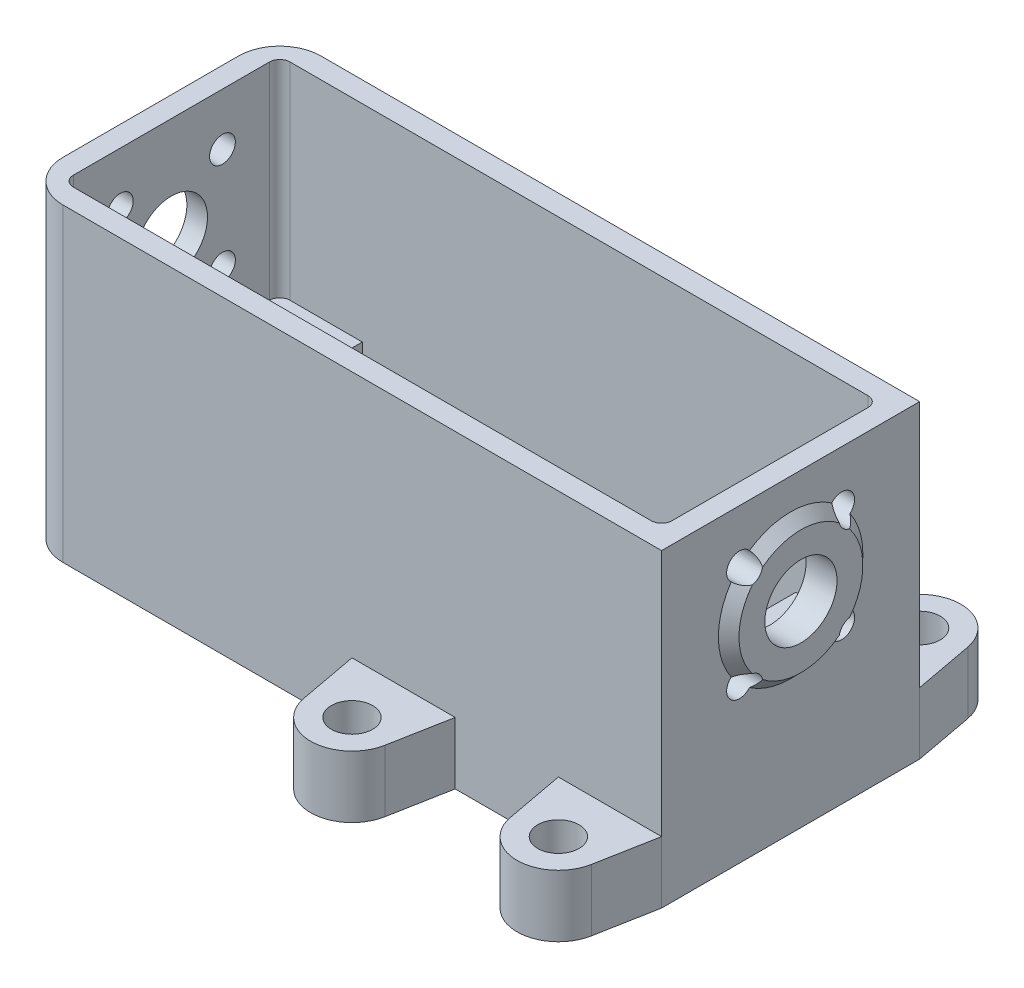
from build123d import *

# Parameters (mm, degrees)
SKETCH_1_W          = 62
SKETCH_1_H          = 25
EXTRUDE_1_DEPTH     = 30
SHELL_1_T           = -2
SKETCH_2_W          = 8
SKETCH_2_H          = 21
EXTRUDE_2_DEPTH     = 8
SKETCH_3_R          = 2
CUT_EXTRUDE_1_DEPTH = 39.951893407
SKETCH_4_R          = 6
CUT_EXTRUDE_2_DEPTH = 44.603325561
SKETCH_5_R          = 2
EXTRUDE_3_DEPTH     = 6
SKETCH_6_R          = 7
EXTRUDE_4_DEPTH     = 1
SKETCH_10_R         = 3.5
SKETCH_10_R_2       = 1.25
CUT_EXTRUDE_3_DEPTH = 74.015409333
FILLET_1_R          = 4
FILLET_2_R          = 1


with BuildPart() as part:
    # 草图1 → 凸台-拉伸1 (new body)
    with BuildSketch(Plane(origin=(0, 0, 0), x_dir=(1, 0, 0), z_dir=(0, 1, 0))):
        Rectangle(SKETCH_1_W, SKETCH_1_H)
    extrude(amount=EXTRUDE_1_DEPTH)

    # 抽壳1
    shell_1_openings = [part.faces().sort_by_distance(p)[0] for p in [
        (0, 30, 0),
    ]]
    offset(amount=SHELL_1_T, openings=shell_1_openings, kind=Kind.INTERSECTION)

    # 草图2 → 凸台-拉伸2 (add)
    with BuildSketch(Plane(origin=(0, 2, 0), x_dir=(1, 0, 0), z_dir=(0, 1, 0))):
        with Locations((-25, 0)):
            Rectangle(SKETCH_2_W, SKETCH_2_H)
        with Locations((25, 0)):
            Rectangle(SKETCH_2_W, SKETCH_2_H)
    extrude(amount=EXTRUDE_2_DEPTH)

    # 草图3 → 切除-拉伸1 (cut, through all)
    with BuildSketch(Plane(origin=(0, 10, 0), x_dir=(1, 0, 0), z_dir=(0, 1, 0))):
        with Locations(Location((25, -5, 0), (0, 0, 270))):
            Circle(SKETCH_3_R)
        with Locations(Location((25, 5, 0), (0, 0, 270))):
            Circle(SKETCH_3_R)
        with Locations(Location((-25, 5, 0), (0, 0, 90))):
            Circle(SKETCH_3_R)
        with Locations(Location((-25, -5, 0), (0, 0, 90))):
            Circle(SKETCH_3_R)
    extrude(amount=-CUT_EXTRUDE_1_DEPTH, mode=Mode.SUBTRACT)

    # 草图4 → 切除-拉伸2 (cut, through all)
    with BuildSketch(Plane(origin=(0, 2, 0), x_dir=(1, 0, 0), z_dir=(0, 1, 0))):
        with Locations(Location((-12, 0, 0), (0, 0, 270))):
            Circle(SKETCH_4_R)
    extrude(amount=-CUT_EXTRUDE_2_DEPTH, mode=Mode.SUBTRACT)

    # 草图5 → 凸台-拉伸3 (add)
    # profile 1 of 4: a face of its own
    with BuildSketch(Plane(origin=(0, 0, 0), x_dir=(1, 0, 0), z_dir=(0, 1, 0))):
        with BuildLine():
            Line((22.067619242, 18.232380758), (21, 12.5))
            Line((21, 12.5), (31, 12.5))
            Line((31, 12.5), (29.932380758, 18.232380758))
            ThreePointArc((29.932380758, 18.232380758), (26, 21.5), (22.067619242, 18.232380758))
        make_face()
        with Locations(Location((26, 17.5, 0), (0, 0, 270))):
            Circle(SKETCH_5_R, mode=Mode.SUBTRACT)
    # profile 2 of 4: a face of its own
    with BuildSketch(Plane(origin=(0, 0, 0), x_dir=(1, 0, 0), z_dir=(0, 1, 0))):
        with BuildLine():
            Line((2.067619242, 18.232380758), (1, 12.5))
            Line((1, 12.5), (11, 12.5))
            Line((11, 12.5), (9.932380758, 18.232380758))
            ThreePointArc((9.932380758, 18.232380758), (6, 21.5), (2.067619242, 18.232380758))
        make_face()
        with Locations(Location((6, 17.5, 0), (0, 0, 270))):
            Circle(SKETCH_5_R, mode=Mode.SUBTRACT)
    # profile 3 of 4: a face of its own
    with BuildSketch(Plane(origin=(0, 0, 0), x_dir=(1, 0, 0), z_dir=(0, 1, 0))):
        with BuildLine():
            Line((11, -12.5), (9.932380758, -18.232380758))
            ThreePointArc((9.932380758, -18.232380758), (6, -21.5), (2.067619242, -18.232380758))
            Line((2.067619242, -18.232380758), (1, -12.5))
            Line((1, -12.5), (11, -12.5))
        make_face()
        with Locations(Location((6, -17.5, 0), (0, 0, 90))):
            Circle(SKETCH_5_R, mode=Mode.SUBTRACT)
    # profile 4 of 4: a face of its own
    with BuildSketch(Plane(origin=(0, 0, 0), x_dir=(1, 0, 0), z_dir=(0, 1, 0))):
        with BuildLine():
            Line((31, -12.5), (29.932380758, -18.232380758))
            ThreePointArc((29.932380758, -18.232380758), (26, -21.5), (22.067619242, -18.232380758))
            Line((22.067619242, -18.232380758), (21, -12.5))
            Line((21, -12.5), (31, -12.5))
        make_face()
        with Locations(Location((26, -17.5, 0), (0, 0, 90))):
            Circle(SKETCH_5_R, mode=Mode.SUBTRACT)
    extrude(amount=EXTRUDE_3_DEPTH)

    # 草图6 → 凸台-拉伸4 (add)
    with BuildSketch(Plane(origin=(31, 0, 0), x_dir=(0, 0, -1), z_dir=(1, 0, 0))):
        with Locations((0, 20)):
            Circle(SKETCH_6_R)
    extrude(amount=EXTRUDE_4_DEPTH)

    # 草图7 → 切除-旋转1 (revolve, cut)
    with BuildSketch(Plane.XY, mode=Mode.PRIVATE) as cut_revolve_1_sk:
        Polygon((31, 27), (33, 27), (33, 25), align=None)
    revolve(cut_revolve_1_sk.sketch.rotate(Axis((32, 20, 0), (-1, 0, 0)), 90), axis=Axis((32, 20, 0), (-1, 0, 0)), mode=Mode.SUBTRACT)

    # 草图10 → 切除-拉伸3 (cut, through all)
    with BuildSketch(Plane.ZY.offset(31)):
        with Locations((0, 20)):
            Circle(SKETCH_10_R)
        with Locations((-4.949747468, 24.949747468)):
            Circle(SKETCH_10_R_2)
        with Locations((4.949747468, 24.949747468)):
            Circle(SKETCH_10_R_2)
        with Locations((4.949747468, 15.050252532)):
            Circle(SKETCH_10_R_2)
        with Locations((-4.949747468, 15.050252532)):
            Circle(SKETCH_10_R_2)
    extrude(amount=-CUT_EXTRUDE_3_DEPTH, mode=Mode.SUBTRACT)

    # 圆角1
    fillet_1_edges = [part.edges().sort_by_distance(p)[0] for p in [
        (-31, 15, 12.5),
        (-31, 15, -12.5),
    ]]
    fillet(fillet_1_edges, radius=FILLET_1_R)

    # 圆角2
    fillet_2_edges = [part.edges().sort_by_distance(p)[0] for p in [
        (29, 20, 10.5),
        (29, 20, -10.5),
        (-29, 20, -10.5),
        (-29, 20, 10.5),
    ]]
    fillet(fillet_2_edges, radius=FILLET_2_R)


solid = part.part
